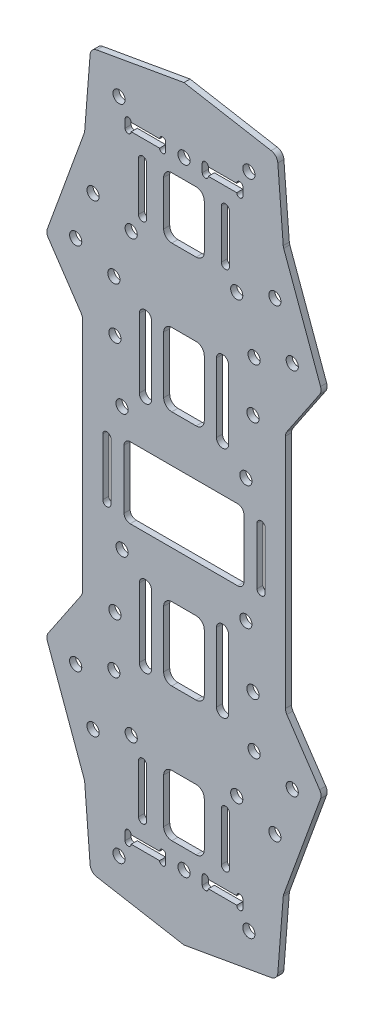
from build123d import *

# Parameters (mm, degrees)
SKETCH1_R          = 1.5
BOTTOM_PLATE_DEPTH = 1.5


with BuildPart() as part:
    # Sketch1 → bottom-plate (new body)
    with BuildSketch(Plane.XY):
        with BuildLine():
            Line((-24.571418021, 68.904816085), (-33.651464065, 43.95759461))
            ThreePointArc((-33.651464065, 43.95759461), (-33.757171127, 43.029815637), (-33.430153969, 42.155168516))
            Line((-33.430153969, 42.155168516), (-25.341924855, 30.163875727))
            ThreePointArc((-25.341924855, 30.163875727), (-25.087390488, 29.63023333), (-25, 29.04548992))
            Line((-25, 29.04548992), (-25, -29.04548992))
            ThreePointArc((-25, -29.04548992), (-25.087390488, -29.63023333), (-25.341924855, -30.163875727))
            Line((-25.341924855, -30.163875727), (-33.430153969, -42.155168516))
            ThreePointArc((-33.430153969, -42.155168516), (-33.757171127, -43.029815637), (-33.651464065, -43.95759461))
            Line((-33.651464065, -43.95759461), (-24.571418021, -68.904816085))
            ThreePointArc((-24.571418021, -68.904816085), (-24.49634105, -69.164501027), (-24.456968595, -69.43193818))
            Line((-24.456968595, -69.43193818), (-23.121499045, -86.400687699))
            ThreePointArc((-23.121499045, -86.400687699), (-22.608100633, -87.588503122), (-21.474960733, -88.213385013))
            Line((-21.474960733, -88.213385013), (0, -92))
            Line((0, -92), (21.474960733, -88.213385013))
            ThreePointArc((21.474960733, -88.213385013), (22.608100633, -87.588503122), (23.121499045, -86.400687699))
            Line((23.121499045, -86.400687699), (24.456968595, -69.43193818))
            ThreePointArc((24.456968595, -69.43193818), (24.49634105, -69.164501027), (24.571418021, -68.904816085))
            Line((24.571418021, -68.904816085), (33.651464065, -43.95759461))
            ThreePointArc((33.651464065, -43.95759461), (33.757171127, -43.029815637), (33.430153969, -42.155168516))
            Line((33.430153969, -42.155168516), (25.341924855, -30.163875727))
            ThreePointArc((25.341924855, -30.163875727), (25.087390488, -29.63023333), (25, -29.04548992))
            Line((25, -29.04548992), (25, 29.04548992))
            ThreePointArc((25, 29.04548992), (25.087390488, 29.63023333), (25.341924855, 30.163875727))
            Line((25.341924855, 30.163875727), (33.430153969, 42.155168516))
            ThreePointArc((33.430153969, 42.155168516), (33.757171127, 43.029815637), (33.651464065, 43.95759461))
            Line((33.651464065, 43.95759461), (24.571418021, 68.904816085))
            ThreePointArc((24.571418021, 68.904816085), (24.49634105, 69.164501027), (24.456968595, 69.43193818))
            Line((24.456968595, 69.43193818), (23.121499045, 86.400687699))
            ThreePointArc((23.121499045, 86.400687699), (22.608100633, 87.588503122), (21.474960733, 88.213385013))
            Line((21.474960733, 88.213385013), (0, 92))
            Line((0, 92), (-21.474960733, 88.213385013))
            ThreePointArc((-21.474960733, 88.213385013), (-22.608100633, 87.588503122), (-23.121499045, 86.400687699))
            Line((-23.121499045, 86.400687699), (-24.456968595, 69.43193818))
            ThreePointArc((-24.456968595, 69.43193818), (-24.49634105, 69.164501027), (-24.571418021, 68.904816085))
        make_face()
        with Locations(Location((-16, 81, 0), (0, 0, 180))):
            Circle(SKETCH1_R, mode=Mode.SUBTRACT)
        with Locations(Location((0, 76, 0), (0, 0, 180))):
            Circle(SKETCH1_R, mode=Mode.SUBTRACT)
        with Locations(Location((-26.672177999, 45.420201433, 0), (0, 0, 180))):
            Circle(SKETCH1_R, mode=Mode.SUBTRACT)
        with Locations(Location((-22.396926208, 57.166359193, 0), (0, 0, 180))):
            Circle(SKETCH1_R, mode=Mode.SUBTRACT)
        with Locations(Location((-17.275251792, 42, 0), (0, 0, 180))):
            Circle(SKETCH1_R, mode=Mode.SUBTRACT)
        with Locations(Location((-13, 53.74615776, 0), (0, 0, 180))):
            Circle(SKETCH1_R, mode=Mode.SUBTRACT)
        with Locations(Location((-17, 29.5, 0), (0, 0, 180))):
            Circle(SKETCH1_R, mode=Mode.SUBTRACT)
        with Locations(Location((-15.25, 15.25, 0), (0, 0, 180))):
            Circle(SKETCH1_R, mode=Mode.SUBTRACT)
        with Locations(Location((15.25, 15.25, 0), (0, 0, 180))):
            Circle(SKETCH1_R, mode=Mode.SUBTRACT)
        with Locations(Location((17, 29.5, 0), (0, 0, 180))):
            Circle(SKETCH1_R, mode=Mode.SUBTRACT)
        with Locations(Location((13, 53.74615776, 0), (0, 0, 180))):
            Circle(SKETCH1_R, mode=Mode.SUBTRACT)
        with Locations(Location((17.275251792, 42, 0), (0, 0, 180))):
            Circle(SKETCH1_R, mode=Mode.SUBTRACT)
        with Locations(Location((22.396926208, 57.166359193, 0), (0, 0, 180))):
            Circle(SKETCH1_R, mode=Mode.SUBTRACT)
        with Locations(Location((26.672177999, 45.420201433, 0), (0, 0, 180))):
            Circle(SKETCH1_R, mode=Mode.SUBTRACT)
        with Locations(Location((16, 81, 0), (0, 0, 180))):
            Circle(SKETCH1_R, mode=Mode.SUBTRACT)
        with Locations(Location((16, -81, 0), (0, 0, 180))):
            Circle(SKETCH1_R, mode=Mode.SUBTRACT)
        with Locations(Location((26.672177999, -45.420201433, 0), (0, 0, 180))):
            Circle(SKETCH1_R, mode=Mode.SUBTRACT)
        with Locations(Location((22.396926208, -57.166359193, 0), (0, 0, 180))):
            Circle(SKETCH1_R, mode=Mode.SUBTRACT)
        with Locations(Location((17.275251792, -42, 0), (0, 0, 180))):
            Circle(SKETCH1_R, mode=Mode.SUBTRACT)
        with Locations(Location((13, -53.74615776, 0), (0, 0, 180))):
            Circle(SKETCH1_R, mode=Mode.SUBTRACT)
        with Locations(Location((17, -29.5, 0), (0, 0, 180))):
            Circle(SKETCH1_R, mode=Mode.SUBTRACT)
        with Locations(Location((15.25, -15.25, 0), (0, 0, 180))):
            Circle(SKETCH1_R, mode=Mode.SUBTRACT)
        with Locations(Location((-15.25, -15.25, 0), (0, 0, 180))):
            Circle(SKETCH1_R, mode=Mode.SUBTRACT)
        with Locations(Location((-17, -29.5, 0), (0, 0, 180))):
            Circle(SKETCH1_R, mode=Mode.SUBTRACT)
        with Locations(Location((-13, -53.74615776, 0), (0, 0, 180))):
            Circle(SKETCH1_R, mode=Mode.SUBTRACT)
        with Locations(Location((-17.275251792, -42, 0), (0, 0, 180))):
            Circle(SKETCH1_R, mode=Mode.SUBTRACT)
        with Locations(Location((-22.396926208, -57.166359193, 0), (0, 0, 180))):
            Circle(SKETCH1_R, mode=Mode.SUBTRACT)
        with Locations(Location((-26.672177999, -45.420201433, 0), (0, 0, 180))):
            Circle(SKETCH1_R, mode=Mode.SUBTRACT)
        with Locations(Location((0, -76, 0), (0, 0, 180))):
            Circle(SKETCH1_R, mode=Mode.SUBTRACT)
        with Locations(Location((-16, -81, 0), (0, 0, 180))):
            Circle(SKETCH1_R, mode=Mode.SUBTRACT)
        with BuildLine():
            Line((20, 7), (20, -7))
            ThreePointArc((20, -7), (19, -8), (18, -7))
            Line((18, -7), (18, 7))
            ThreePointArc((18, 7), (19, 8), (20, 7))
        make_face(mode=Mode.SUBTRACT)
        with BuildLine():
            Line((-18, 7), (-18, -7))
            ThreePointArc((-18, -7), (-19, -8), (-20, -7))
            Line((-20, -7), (-20, 7))
            ThreePointArc((-20, 7), (-19, 8), (-18, 7))
        make_face(mode=Mode.SUBTRACT)
        with BuildLine():
            Line((-11.2, -70.25), (-11.2, -58.25))
            ThreePointArc((-11.2, -58.25), (-10.2, -57.25), (-9.2, -58.25))
            Line((-9.2, -58.25), (-9.2, -70.25))
            ThreePointArc((-9.2, -70.25), (-10.2, -71.25), (-11.2, -70.25))
        make_face(mode=Mode.SUBTRACT)
        with BuildLine():
            Line((-11, -37.25), (-11, -20.25))
            ThreePointArc((-11, -20.25), (-9.5, -18.75), (-8, -20.25))
            Line((-8, -20.25), (-8, -37.25))
            ThreePointArc((-8, -37.25), (-9.5, -38.75), (-11, -37.25))
        make_face(mode=Mode.SUBTRACT)
        with BuildLine():
            Line((8, -37.25), (8, -20.25))
            ThreePointArc((8, -20.25), (9.5, -18.75), (11, -20.25))
            Line((11, -20.25), (11, -37.25))
            ThreePointArc((11, -37.25), (9.5, -38.75), (8, -37.25))
        make_face(mode=Mode.SUBTRACT)
        with BuildLine():
            Line((9.2, -70.25), (9.2, -58.25))
            ThreePointArc((9.2, -58.25), (10.2, -57.25), (11.2, -58.25))
            Line((11.2, -58.25), (11.2, -70.25))
            ThreePointArc((11.2, -70.25), (10.2, -71.25), (9.2, -70.25))
        make_face(mode=Mode.SUBTRACT)
        with BuildLine():
            Line((-3, -20.25), (3, -20.25))
            ThreePointArc((3, -20.25), (4.414213562, -20.835786438), (5, -22.25))
            Line((5, -22.25), (5, -36.25))
            ThreePointArc((5, -36.25), (4.414213562, -37.664213562), (3, -38.25))
            Line((3, -38.25), (-3, -38.25))
            ThreePointArc((-3, -38.25), (-4.414213562, -37.664213562), (-5, -36.25))
            Line((-5, -36.25), (-5, -22.25))
            ThreePointArc((-5, -22.25), (-4.414213562, -20.835786438), (-3, -20.25))
        make_face(mode=Mode.SUBTRACT)
        with BuildLine():
            Line((5, -58.25), (5, -69.25))
            ThreePointArc((5, -69.25), (4.414213562, -70.664213562), (3, -71.25))
            Line((3, -71.25), (-3, -71.25))
            ThreePointArc((-3, -71.25), (-4.414213562, -70.664213562), (-5, -69.25))
            Line((-5, -69.25), (-5, -58.25))
            ThreePointArc((-5, -58.25), (-4.414213562, -56.835786438), (-3, -56.25))
            Line((-3, -56.25), (3, -56.25))
            ThreePointArc((3, -56.25), (4.414213562, -56.835786438), (5, -58.25))
        make_face(mode=Mode.SUBTRACT)
        with BuildLine():
            Line((11.2, 70.25), (11.2, 58.25))
            ThreePointArc((11.2, 58.25), (10.2, 57.25), (9.2, 58.25))
            Line((9.2, 58.25), (9.2, 70.25))
            ThreePointArc((9.2, 70.25), (10.2, 71.25), (11.2, 70.25))
        make_face(mode=Mode.SUBTRACT)
        with BuildLine():
            Line((11, 37.25), (11, 20.25))
            ThreePointArc((11, 20.25), (9.5, 18.75), (8, 20.25))
            Line((8, 20.25), (8, 37.25))
            ThreePointArc((8, 37.25), (9.5, 38.75), (11, 37.25))
        make_face(mode=Mode.SUBTRACT)
        with BuildLine():
            Line((-8, 37.25), (-8, 20.25))
            ThreePointArc((-8, 20.25), (-9.5, 18.75), (-11, 20.25))
            Line((-11, 20.25), (-11, 37.25))
            ThreePointArc((-11, 37.25), (-9.5, 38.75), (-8, 37.25))
        make_face(mode=Mode.SUBTRACT)
        with BuildLine():
            Line((-9.2, 70.25), (-9.2, 58.25))
            ThreePointArc((-9.2, 58.25), (-10.2, 57.25), (-11.2, 58.25))
            Line((-11.2, 58.25), (-11.2, 70.25))
            ThreePointArc((-11.2, 70.25), (-10.2, 71.25), (-9.2, 70.25))
        make_face(mode=Mode.SUBTRACT)
        with BuildLine():
            Line((13.25, -8.75), (-13.25, -8.75))
            ThreePointArc((-13.25, -8.75), (-14.310660172, -8.310660172), (-14.75, -7.25))
            Line((-14.75, -7.25), (-14.75, 7.25))
            ThreePointArc((-14.75, 7.25), (-14.310660172, 8.310660172), (-13.25, 8.75))
            Line((-13.25, 8.75), (13.25, 8.75))
            ThreePointArc((13.25, 8.75), (14.310660172, 8.310660172), (14.75, 7.25))
            Line((14.75, 7.25), (14.75, -7.25))
            ThreePointArc((14.75, -7.25), (14.310660172, -8.310660172), (13.25, -8.75))
        make_face(mode=Mode.SUBTRACT)
        with BuildLine():
            Line((-5, 58.25), (-5, 69.25))
            ThreePointArc((-5, 69.25), (-4.414213562, 70.664213562), (-3, 71.25))
            Line((-3, 71.25), (3, 71.25))
            ThreePointArc((3, 71.25), (4.414213562, 70.664213562), (5, 69.25))
            Line((5, 69.25), (5, 58.25))
            ThreePointArc((5, 58.25), (4.414213562, 56.835786438), (3, 56.25))
            Line((3, 56.25), (-3, 56.25))
            ThreePointArc((-3, 56.25), (-4.414213562, 56.835786438), (-5, 58.25))
        make_face(mode=Mode.SUBTRACT)
        with BuildLine():
            Line((-3, 38.25), (3, 38.25))
            ThreePointArc((3, 38.25), (4.414213562, 37.664213562), (5, 36.25))
            Line((5, 36.25), (5, 22.25))
            ThreePointArc((5, 22.25), (4.414213562, 20.835786438), (3, 20.25))
            Line((3, 20.25), (-3, 20.25))
            ThreePointArc((-3, 20.25), (-4.414213562, 20.835786438), (-5, 22.25))
            Line((-5, 22.25), (-5, 36.25))
            ThreePointArc((-5, 36.25), (-4.414213562, 37.664213562), (-3, 38.25))
        make_face(mode=Mode.SUBTRACT)
        with BuildLine():
            Line((-14.5, 75), (-14.5, 77))
            ThreePointArc((-14.5, 77), (-13.75, 77.75), (-13, 77))
            Line((-13, 77), (-6, 77))
            ThreePointArc((-6, 77), (-5.25, 77.75), (-4.5, 77))
            Line((-4.5, 77), (-4.5, 75))
            ThreePointArc((-4.5, 75), (-5.25, 74.25), (-6, 75))
            Line((-6, 75), (-13, 75))
            ThreePointArc((-13, 75), (-13.75, 74.25), (-14.5, 75))
        make_face(mode=Mode.SUBTRACT)
        with BuildLine():
            Line((6, 77), (13, 77))
            ThreePointArc((13, 77), (13.75, 77.75), (14.5, 77))
            Line((14.5, 77), (14.5, 75))
            ThreePointArc((14.5, 75), (13.75, 74.25), (13, 75))
            Line((13, 75), (6, 75))
            ThreePointArc((6, 75), (5.25, 74.25), (4.5, 75))
            Line((4.5, 75), (4.5, 77))
            ThreePointArc((4.5, 77), (5.25, 77.75), (6, 77))
        make_face(mode=Mode.SUBTRACT)
        with BuildLine():
            Line((13, -77), (6, -77))
            ThreePointArc((6, -77), (5.25, -77.75), (4.5, -77))
            Line((4.5, -77), (4.5, -75))
            ThreePointArc((4.5, -75), (5.25, -74.25), (6, -75))
            Line((6, -75), (13, -75))
            ThreePointArc((13, -75), (13.75, -74.25), (14.5, -75))
            Line((14.5, -75), (14.5, -77))
            ThreePointArc((14.5, -77), (13.75, -77.75), (13, -77))
        make_face(mode=Mode.SUBTRACT)
        with BuildLine():
            Line((-6, -77), (-13, -77))
            ThreePointArc((-13, -77), (-13.75, -77.75), (-14.5, -77))
            Line((-14.5, -77), (-14.5, -75))
            ThreePointArc((-14.5, -75), (-13.75, -74.25), (-13, -75))
            Line((-13, -75), (-6, -75))
            ThreePointArc((-6, -75), (-5.25, -74.25), (-4.5, -75))
            Line((-4.5, -75), (-4.5, -77))
            ThreePointArc((-4.5, -77), (-5.25, -77.75), (-6, -77))
        make_face(mode=Mode.SUBTRACT)
    extrude(amount=-BOTTOM_PLATE_DEPTH)


solid = part.part
